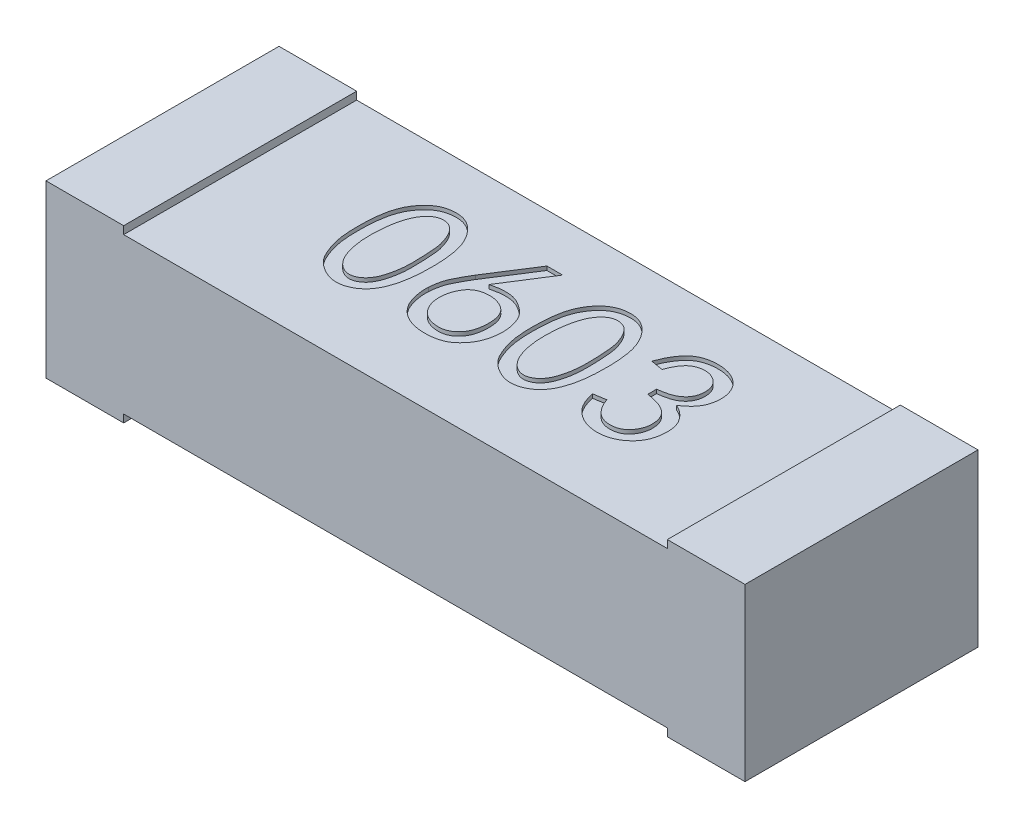
from build123d import *

# Parameters (mm, degrees)
SKETCH_1_W           = 1.4
SKETCH_1_H           = 0.6
EXTRUDE_1_DEPTH      = 0.4
EXTRUDE_2_DEPTH      = 0.42
EXTRUDE_2_DEPTH_BACK = 0.02
SKETCH_3_W           = 0.2
SKETCH_3_H           = 0.6
CUT_EXTRUDE_1_DEPTH  = 0.01


with BuildPart() as part:
    # 草图1 → 凸台-拉伸1 (new body)
    with BuildSketch(Plane(origin=(0, 0, 0), x_dir=(1, 0, 0), z_dir=(0, 1, 0))):
        with Locations((0.9, 0.3)):
            Rectangle(SKETCH_1_W, SKETCH_1_H)
    extrude(amount=EXTRUDE_1_DEPTH)

    # 草图3 → 凸台-拉伸2 (add, two sides: drawn at the far end of the back side and taken through both)
    with BuildSketch(Plane(origin=(0, 0, 0), x_dir=(1, 0, 0), z_dir=(0, 1, 0)).offset(-EXTRUDE_2_DEPTH_BACK)):
        with Locations((0.1, 0.3)):
            Rectangle(SKETCH_3_W, SKETCH_3_H)
        with Locations((1.7, 0.3)):
            Rectangle(SKETCH_3_W, SKETCH_3_H)
    extrude(amount=EXTRUDE_2_DEPTH + EXTRUDE_2_DEPTH_BACK)

    # 草图4 → 切除-拉伸1 (cut)
    # profile 1 of 4: a face of its own
    with BuildSketch(Plane(origin=(0, 0.4, 0), x_dir=(1, 0, 0), z_dir=(0, 1, 0))):
        with BuildLine():
            add(Edge.make_bspline(
                [(0.483421092, 0.340757497), (0.483588156, 0.344527937), (0.483913999, 0.351881852), (0.484855426, 0.362604689), (0.485992295, 0.372752951), (0.487470375, 0.382295602), (0.489297207, 0.39120088), (0.491364957, 0.399515455), (0.493754568, 0.407216063), (0.497273219, 0.416620761), (0.502549605, 0.427445454), (0.510096898, 0.439342567), (0.518867102, 0.450037235), (0.527163995, 0.457873569), (0.534357962, 0.463388817), (0.540105805, 0.466969689), (0.546144457, 0.470029274), (0.552493722, 0.47252443), (0.559141923, 0.474383081), (0.566071449, 0.475755304), (0.573305168, 0.476604181), (0.58075916, 0.476856733), (0.588269318, 0.476503115), (0.595646974, 0.475351126), (0.602766282, 0.473306052), (0.609632105, 0.470498488), (0.616225758, 0.466891117), (0.62258043, 0.462512914), (0.628620786, 0.457250654), (0.634422109, 0.45131801), (0.639840715, 0.444788663), (0.644804146, 0.437788625), (0.649291783, 0.4303901), (0.653243811, 0.422552499), (0.656786335, 0.414344934), (0.659758198, 0.405694297), (0.662216902, 0.396635733), (0.664924319, 0.383838922), (0.66730626, 0.366864283), (0.668984368, 0.345380882), (0.669367286, 0.322473558), (0.668797114, 0.302663413), (0.667722326, 0.286612625), (0.666500411, 0.274970789), (0.664859168, 0.263922228), (0.662948566, 0.253413162), (0.660558286, 0.243499479), (0.65772578, 0.234170558), (0.654665383, 0.225365453), (0.651063131, 0.217176722), (0.647139714, 0.209534821), (0.642666682, 0.202537638), (0.637820777, 0.196090663), (0.632473539, 0.190244983), (0.626555302, 0.185118355), (0.620271971, 0.1804634), (0.6134548, 0.176501509), (0.60628545, 0.173139459), (0.598901559, 0.170463695), (0.591395312, 0.168719712), (0.583908309, 0.167683158), (0.576387791, 0.167679366), (0.568878315, 0.168333241), (0.561410721, 0.170053295), (0.553892899, 0.172418183), (0.546526215, 0.175762583), (0.539435956, 0.179613492), (0.532762132, 0.183758227), (0.52668713, 0.188268292), (0.521162409, 0.193084671), (0.516119051, 0.198166924), (0.511616575, 0.203563298), (0.507701714, 0.209288735), (0.503326928, 0.217346527), (0.498640135, 0.227740102), (0.49378933, 0.240542491), (0.489824751, 0.253652824), (0.487275446, 0.264919213), (0.485594692, 0.274344409), (0.484669939, 0.282070723), (0.483866651, 0.290387797), (0.483381167, 0.299297568), (0.483058239, 0.30880776), (0.482917695, 0.318925149), (0.483068122, 0.329648558), (0.483301359, 0.336989142), (0.483421092, 0.340757497)],
                knots=[0, 0, 0, 0, 1.18043416, 2.302333746, 3.366253517, 4.374302266, 5.321670991, 6.208995316, 7.053297808, 7.84229274, 9.348259463, 10.810477328, 12.240076564, 13.663562249, 14.3695339, 15.072606272, 15.778577923, 16.484387009, 17.202829605, 17.934942377, 18.692112664, 19.478485278, 20.265441384, 21.040673806, 21.808439453, 22.577161074, 23.356320991, 24.155029842, 24.986154494, 25.858111265, 26.748121484, 27.637306138, 28.540117759, 29.452135788, 30.380885827, 31.334339875, 32.310628684, 33.31521083, 35.42407972, 37.666773946, 40.052062172, 42.587025658, 43.863776122, 45.083322308, 46.247467896, 47.357025429, 48.423487632, 49.435172604, 50.405897663, 51.337337341, 52.231284254, 53.090220275, 53.931690991, 54.751583713, 55.562922169, 56.377338113, 57.194202079, 58.024663732, 58.851830165, 59.645552351, 60.431282623, 61.21044254, 61.99312915, 62.783838437, 63.60230231, 64.454612977, 65.309477934, 66.125301685, 66.909862715, 67.67340185, 68.415973016, 69.147238889, 69.868837108, 70.581506411, 72.0124375, 73.431838244, 74.861437481, 76.292961888, 77.042577341, 77.855187732, 78.726196438, 79.655959089, 80.645695907, 81.702690171, 82.820655125, 84, 84, 84, 84], degree=3))
        make_face()
        with BuildLine():
            add(Edge.make_bspline(
                [(0.520263198, 0.351283812), (0.519864896, 0.347322739), (0.519080229, 0.339519286), (0.518438465, 0.327943015), (0.51825558, 0.316694444), (0.518423053, 0.305769024), (0.519068909, 0.295188132), (0.520170848, 0.28493129), (0.521740527, 0.275005699), (0.523661676, 0.26543768), (0.525963476, 0.256380159), (0.528693228, 0.247956197), (0.531800341, 0.240227159), (0.535237539, 0.233181404), (0.539010532, 0.22681052), (0.543189577, 0.221150685), (0.547657427, 0.216081494), (0.552547605, 0.211821439), (0.557563193, 0.208243912), (0.562691074, 0.205464208), (0.567847614, 0.203494508), (0.573052495, 0.202290148), (0.578286957, 0.201905603), (0.583553085, 0.20227809), (0.588811928, 0.203578168), (0.594037363, 0.20557072), (0.59907947, 0.208315091), (0.60384948, 0.211628932), (0.608247937, 0.215586369), (0.612277165, 0.220144921), (0.615914125, 0.225332787), (0.619241879, 0.231061275), (0.622163899, 0.237425401), (0.625599944, 0.246743615), (0.629060369, 0.259152981), (0.632139015, 0.274659542), (0.633954876, 0.290830865), (0.634430976, 0.307422637), (0.634121416, 0.323908613), (0.633750138, 0.339878961), (0.632857387, 0.355063835), (0.631788941, 0.369540555), (0.629975689, 0.383373758), (0.626634107, 0.396490988), (0.62195353, 0.408927814), (0.617149426, 0.418745421), (0.612545308, 0.425871899), (0.608915773, 0.43065356), (0.604880657, 0.434649212), (0.600625861, 0.438055528), (0.596052409, 0.440648828), (0.59120166, 0.442588677), (0.586075734, 0.443790817), (0.580752311, 0.44438357), (0.575389145, 0.444279948), (0.570121221, 0.443338612), (0.565011869, 0.441692346), (0.560028939, 0.439348685), (0.555276977, 0.436176606), (0.550680027, 0.432294276), (0.546289876, 0.427636321), (0.541965295, 0.422329158), (0.538020525, 0.416166508), (0.534372309, 0.409263181), (0.53113702, 0.40153048), (0.528239485, 0.393013161), (0.525637219, 0.383711685), (0.523449237, 0.373620457), (0.521633598, 0.362731434), (0.52073041, 0.355186667), (0.520263198, 0.351283812)],
                knots=[0, 0, 0, 0, 1.378198314, 2.715098627, 4.012594964, 5.272602849, 6.497213731, 7.681415101, 8.842769074, 9.975170128, 11.059162755, 12.076494648, 13.038717388, 13.940857576, 14.788360499, 15.598271168, 16.373595835, 17.122768248, 17.838466736, 18.502782022, 19.136468245, 19.744060339, 20.345653328, 20.947246317, 21.563841626, 22.214212994, 22.87852828, 23.546305104, 24.220743313, 24.921956094, 25.648106704, 26.41081768, 27.212668989, 28.069279432, 29.84713992, 31.666334073, 33.537864714, 35.473745168, 37.408579624, 39.246547954, 41.003985019, 42.674193204, 44.272363647, 45.827394737, 47.348405091, 48.867584295, 49.599750274, 50.283750763, 50.94125936, 51.560811542, 52.165388272, 52.754418158, 53.363720025, 53.982318455, 54.604903792, 55.213928724, 55.828148287, 56.458765578, 57.113918044, 57.800421407, 58.537638978, 59.326979919, 60.167286366, 61.066273245, 62.027297208, 63.065989643, 64.179487018, 65.369443928, 66.639232213, 68, 68, 68, 68], degree=3))
        make_face(mode=Mode.SUBTRACT)
    # profile 2 of 4: a face of its own
    with BuildSketch(Plane(origin=(0, 0.4, 0), x_dir=(1, 0, 0), z_dir=(0, 1, 0))):
        with BuildLine():
            add(Edge.make_bspline(
                [(0.9325439, 0.340757497), (0.932710963, 0.344527937), (0.933036806, 0.351881852), (0.933978233, 0.362604689), (0.935115102, 0.372752951), (0.936593182, 0.382295602), (0.938420014, 0.39120088), (0.940487764, 0.399515455), (0.942877375, 0.407216063), (0.946396026, 0.416620761), (0.951672412, 0.427445454), (0.959219705, 0.439342567), (0.967989909, 0.450037235), (0.976286802, 0.457873569), (0.983480769, 0.463388817), (0.989228612, 0.466969689), (0.995267264, 0.470029274), (1.001616529, 0.47252443), (1.00826473, 0.474383081), (1.015194256, 0.475755304), (1.022427975, 0.476604181), (1.029881967, 0.476856733), (1.037392125, 0.476503115), (1.044769781, 0.475351126), (1.051889089, 0.473306052), (1.058754912, 0.470498488), (1.065348565, 0.466891117), (1.071703237, 0.462512914), (1.077743593, 0.457250654), (1.083544916, 0.45131801), (1.088963522, 0.444788663), (1.093926953, 0.437788625), (1.09841459, 0.4303901), (1.102366618, 0.422552499), (1.105909142, 0.414344934), (1.108881005, 0.405694297), (1.111339709, 0.396635733), (1.114047126, 0.383838922), (1.116429067, 0.366864283), (1.118107175, 0.345380882), (1.118490093, 0.322473558), (1.117919921, 0.302663413), (1.116845133, 0.286612625), (1.115623219, 0.274970789), (1.113981975, 0.263922228), (1.112071373, 0.253413162), (1.109681093, 0.243499479), (1.106848587, 0.234170558), (1.10378819, 0.225365453), (1.100185938, 0.217176722), (1.096262521, 0.209534821), (1.091789489, 0.202537638), (1.086943584, 0.196090663), (1.081596346, 0.190244983), (1.075678109, 0.185118355), (1.069394778, 0.1804634), (1.062577607, 0.176501509), (1.055408257, 0.173139459), (1.048024366, 0.170463695), (1.040518119, 0.168719712), (1.033031116, 0.167683158), (1.025510598, 0.167679366), (1.018001122, 0.168333241), (1.010533528, 0.170053295), (1.003015706, 0.172418183), (0.995649022, 0.175762583), (0.988558763, 0.179613492), (0.981884939, 0.183758227), (0.975809937, 0.188268292), (0.970285216, 0.193084671), (0.965241858, 0.198166924), (0.960739382, 0.203563298), (0.956824521, 0.209288735), (0.952449735, 0.217346527), (0.947762942, 0.227740102), (0.942912137, 0.240542491), (0.938947558, 0.253652824), (0.936398253, 0.264919213), (0.934717499, 0.274344409), (0.933792746, 0.282070723), (0.932989458, 0.290387797), (0.932503974, 0.299297568), (0.932181046, 0.30880776), (0.932040502, 0.318925149), (0.932190929, 0.329648558), (0.932424166, 0.336989142), (0.9325439, 0.340757497)],
                knots=[0, 0, 0, 0, 1.18043416, 2.302333746, 3.366253517, 4.374302266, 5.321670991, 6.208995316, 7.053297808, 7.84229274, 9.348259463, 10.810477328, 12.240076564, 13.663562249, 14.3695339, 15.072606272, 15.778577923, 16.484387009, 17.202829605, 17.934942377, 18.692112664, 19.478485278, 20.265441384, 21.040673806, 21.808439453, 22.577161074, 23.356320991, 24.155029842, 24.986154494, 25.858111265, 26.748121484, 27.637306138, 28.540117759, 29.452135788, 30.380885827, 31.334339875, 32.310628684, 33.31521083, 35.42407972, 37.666773946, 40.052062172, 42.587025658, 43.863776122, 45.083322308, 46.247467896, 47.357025429, 48.423487632, 49.435172604, 50.405897663, 51.337337341, 52.231284254, 53.090220275, 53.931690991, 54.751583713, 55.562922169, 56.377338113, 57.194202079, 58.024663732, 58.851830165, 59.645552351, 60.431282623, 61.21044254, 61.99312915, 62.783838437, 63.60230231, 64.454612977, 65.309477934, 66.125301685, 66.909862715, 67.67340185, 68.415973016, 69.147238889, 69.868837108, 70.581506411, 72.0124375, 73.431838244, 74.861437481, 76.292961888, 77.042577341, 77.855187732, 78.726196438, 79.655959089, 80.645695907, 81.702690171, 82.820655125, 84, 84, 84, 84], degree=3))
        make_face()
        with BuildLine():
            add(Edge.make_bspline(
                [(0.969386005, 0.351283812), (0.968987703, 0.347322739), (0.968203036, 0.339519286), (0.967561272, 0.327943015), (0.967378387, 0.316694444), (0.96754586, 0.305769024), (0.968191716, 0.295188132), (0.969293655, 0.28493129), (0.970863334, 0.275005699), (0.972784483, 0.26543768), (0.975086284, 0.256380159), (0.977816035, 0.247956197), (0.980923148, 0.240227159), (0.984360346, 0.233181404), (0.988133339, 0.22681052), (0.992312384, 0.221150685), (0.996780234, 0.216081494), (1.001670412, 0.211821439), (1.006686, 0.208243912), (1.011813881, 0.205464208), (1.016970421, 0.203494508), (1.022175302, 0.202290148), (1.027409764, 0.201905603), (1.032675893, 0.20227809), (1.037934735, 0.203578168), (1.04316017, 0.20557072), (1.048202277, 0.208315091), (1.052972287, 0.211628932), (1.057370744, 0.215586369), (1.061399972, 0.220144921), (1.065036932, 0.225332787), (1.068364686, 0.231061275), (1.071286707, 0.237425401), (1.074722751, 0.246743615), (1.078183176, 0.259152981), (1.081261822, 0.274659542), (1.083077683, 0.290830865), (1.083553783, 0.307422637), (1.083244223, 0.323908613), (1.082872945, 0.339878961), (1.081980194, 0.355063835), (1.080911748, 0.369540555), (1.079098496, 0.383373758), (1.075756914, 0.396490988), (1.071076337, 0.408927814), (1.066272233, 0.418745421), (1.061668115, 0.425871899), (1.05803858, 0.43065356), (1.054003464, 0.434649212), (1.049748668, 0.438055528), (1.045175216, 0.440648828), (1.040324467, 0.442588677), (1.035198541, 0.443790817), (1.029875118, 0.44438357), (1.024511952, 0.444279948), (1.019244028, 0.443338612), (1.014134676, 0.441692346), (1.009151746, 0.439348685), (1.004399784, 0.436176606), (0.999802834, 0.432294276), (0.995412683, 0.427636321), (0.991088102, 0.422329158), (0.987143332, 0.416166508), (0.983495116, 0.409263181), (0.980259828, 0.40153048), (0.977362292, 0.393013161), (0.974760026, 0.383711685), (0.972572044, 0.373620457), (0.970756405, 0.362731434), (0.969853217, 0.355186667), (0.969386005, 0.351283812)],
                knots=[0, 0, 0, 0, 1.378198314, 2.715098627, 4.012594964, 5.272602849, 6.497213731, 7.681415101, 8.842769074, 9.975170128, 11.059162755, 12.076494648, 13.038717388, 13.940857576, 14.788360499, 15.598271168, 16.373595835, 17.122768248, 17.838466736, 18.502782022, 19.136468245, 19.744060339, 20.345653328, 20.947246317, 21.563841626, 22.214212994, 22.87852828, 23.546305104, 24.220743313, 24.921956094, 25.648106704, 26.41081768, 27.212668989, 28.069279432, 29.84713992, 31.666334073, 33.537864714, 35.473745168, 37.408579624, 39.246547954, 41.003985019, 42.674193204, 44.272363647, 45.827394737, 47.348405091, 48.867584295, 49.599750274, 50.283750763, 50.94125936, 51.560811542, 52.165388272, 52.754418158, 53.363720025, 53.982318455, 54.604903792, 55.213928724, 55.828148287, 56.458765578, 57.113918044, 57.800421407, 58.537638978, 59.326979919, 60.167286366, 61.066273245, 62.027297208, 63.065989643, 64.179487018, 65.369443928, 66.639232213, 68, 68, 68, 68], degree=3))
        make_face(mode=Mode.SUBTRACT)
    # profile 3 of 4: a face of its own
    with BuildSketch(Plane(origin=(0, 0.4, 0), x_dir=(1, 0, 0), z_dir=(0, 1, 0))):
        with BuildLine():
            add(Edge.make_bspline(
                [(0.709736882, 0.275845216), (0.710074782, 0.27992669), (0.710729053, 0.287829584), (0.712869853, 0.299087527), (0.715520512, 0.309438082), (0.719260015, 0.319037437), (0.724046426, 0.328589253), (0.72936939, 0.339070546), (0.735863708, 0.350554644), (0.740586322, 0.358526797), (0.743070215, 0.36271981)],
                knots=[0, 0, 0, 0, 1.042998706, 2.019541814, 2.916615498, 3.762308625, 4.638715294, 5.638536551, 6.75797084, 8, 8, 8, 8], degree=3))
            Line((0.743070215, 0.36271981), (0.81500004, 0.475000512))
            Line((0.81500004, 0.475000512), (0.855350917, 0.475000512))
            Line((0.855350917, 0.475000512), (0.781666707, 0.359211038))
            add(Edge.make_bspline(
                [(0.781666707, 0.359211038), (0.78551045, 0.360153045), (0.792934792, 0.361972568), (0.803904257, 0.363737386), (0.814267802, 0.364600453), (0.824028506, 0.364625256), (0.833200245, 0.363817866), (0.841773884, 0.36207017), (0.849761248, 0.359404106), (0.857086374, 0.35585222), (0.863766248, 0.351817257), (0.869914743, 0.347635075), (0.875516244, 0.34336845), (0.880532811, 0.338940749), (0.88501044, 0.334392749), (0.888802332, 0.329617531), (0.892217863, 0.324829443), (0.895668712, 0.318103376), (0.899291796, 0.309471899), (0.902458255, 0.298656435), (0.904558063, 0.287401495), (0.905475272, 0.275821923), (0.905467617, 0.264072569), (0.904173998, 0.252355569), (0.901930574, 0.240723429), (0.898472078, 0.229287778), (0.893853127, 0.218073941), (0.887514093, 0.207413437), (0.879652455, 0.19729434), (0.871930313, 0.189478655), (0.865040641, 0.183634189), (0.859169039, 0.179882611), (0.852873314, 0.176558496), (0.846062753, 0.173759643), (0.838783953, 0.171477083), (0.830987074, 0.169829656), (0.822722825, 0.16857601), (0.81408166, 0.167908596), (0.805379701, 0.16767449), (0.796876264, 0.168106509), (0.788689272, 0.168912965), (0.780826944, 0.170275452), (0.77327894, 0.172155134), (0.766102439, 0.174633877), (0.759210878, 0.177573932), (0.752685798, 0.180994601), (0.746550485, 0.184874192), (0.740978213, 0.189273586), (0.735794773, 0.193932014), (0.731173223, 0.199051329), (0.726981318, 0.204504105), (0.723370432, 0.210391505), (0.72011743, 0.216592024), (0.71669119, 0.225361859), (0.713341609, 0.236483345), (0.710669611, 0.249818825), (0.709221469, 0.26293003), (0.70956651, 0.271576049), (0.709736882, 0.275845216)],
                knots=[0, 0, 0, 0, 1.30987361, 2.530072464, 3.674076933, 4.749737101, 5.758005553, 6.717161001, 7.640113921, 8.538216801, 9.406478839, 10.221965151, 10.999356528, 11.736024514, 12.43585607, 13.108943968, 13.753423114, 14.378993464, 15.606901413, 16.848076322, 18.102664827, 19.390785032, 20.688768111, 21.98673138, 23.287623163, 24.605715361, 25.936233508, 27.292778926, 28.698472844, 30.169013905, 30.922829238, 31.684618084, 32.470496446, 33.277520399, 34.118983406, 34.992471271, 35.913332431, 36.884634966, 37.860137434, 38.793368636, 39.701719614, 40.582389804, 41.432879653, 42.274220425, 43.093418803, 43.911360741, 44.711055379, 45.492833336, 46.259332936, 47.015702139, 47.772988627, 48.533121813, 49.299654956, 50.087983324, 51.646482558, 53.138633408, 54.587135849, 56, 56, 56, 56], degree=3))
        make_face()
        with BuildLine():
            add(Edge.make_bspline(
                [(0.764122847, 0.217950479), (0.765461864, 0.216622621), (0.768149418, 0.213957464), (0.772625526, 0.210486629), (0.77742579, 0.207441453), (0.782563269, 0.204945376), (0.787998498, 0.202802114), (0.793795336, 0.201319379), (0.799880981, 0.200083672), (0.806212919, 0.199500201), (0.812587955, 0.199284748), (0.818787986, 0.199927724), (0.824741875, 0.201031099), (0.830393052, 0.202984483), (0.835794225, 0.205498514), (0.840901912, 0.208708726), (0.845671164, 0.212619131), (0.850210379, 0.217050705), (0.854320442, 0.222146276), (0.857903316, 0.227842957), (0.8609565, 0.234092578), (0.863426952, 0.240889954), (0.865287912, 0.248209628), (0.866646234, 0.256051905), (0.867491505, 0.264454531), (0.867714636, 0.273203697), (0.867451022, 0.281894646), (0.866453952, 0.290087731), (0.864666729, 0.297539228), (0.862374367, 0.304348354), (0.859246871, 0.310404242), (0.855416825, 0.315765012), (0.850931214, 0.320425775), (0.845713563, 0.324231027), (0.840170749, 0.327431592), (0.834421001, 0.330106449), (0.828534253, 0.332270327), (0.822473407, 0.333912249), (0.816204707, 0.334952629), (0.809765805, 0.335384554), (0.803183374, 0.335315413), (0.796553205, 0.334744075), (0.790048242, 0.333633585), (0.783940175, 0.331792108), (0.778252601, 0.329445403), (0.773023554, 0.326470094), (0.76834358, 0.322770191), (0.764044199, 0.31858346), (0.760277936, 0.313732594), (0.75592562, 0.306555427), (0.751618502, 0.296959561), (0.748030468, 0.284942166), (0.746279303, 0.272570974), (0.746299828, 0.262130981), (0.747132968, 0.25389128), (0.748236432, 0.247933805), (0.749814752, 0.242272668), (0.751749065, 0.236845066), (0.754165874, 0.231689531), (0.757041086, 0.226799855), (0.760334177, 0.222175099), (0.762860979, 0.219357546), (0.764122847, 0.217950479)],
                knots=[0, 0, 0, 0, 0.824379014, 1.654618615, 2.472217002, 3.307040171, 4.149944448, 5.023399345, 5.920986251, 6.863846236, 7.802124107, 8.706338671, 9.585327007, 10.445314643, 11.314286422, 12.187124327, 13.076521263, 14.007883694, 14.9579535, 15.93325223, 16.946080417, 17.995267438, 19.091535754, 20.245890406, 21.474436714, 22.782621587, 24.072176649, 25.275692408, 26.385796877, 27.419682211, 28.411368294, 29.355370333, 30.293504652, 31.227802789, 32.170424673, 33.090341057, 33.998667172, 34.911184711, 35.833391934, 36.773820451, 37.730905064, 38.710612777, 39.6827302, 40.612114241, 41.495534864, 42.369965774, 43.234275376, 44.098636918, 44.989546864, 45.912629924, 47.765713501, 49.573670898, 51.382745352, 53.211540175, 54.12612168, 55.003320594, 55.858492095, 56.694765964, 57.521374723, 58.34531796, 59.173662839, 60, 60, 60, 60], degree=3))
        make_face(mode=Mode.SUBTRACT)
    # profile 4 of 4: a face of its own
    with BuildSketch(Plane(origin=(0, 0.4, 0), x_dir=(1, 0, 0), z_dir=(0, 1, 0))):
        with BuildLine():
            Line((1.158859689, 0.248684722), (1.190438636, 0.25394788))
            add(Edge.make_bspline(
                [(1.190438636, 0.25394788), (1.191683415, 0.250269146), (1.194128328, 0.243043618), (1.199411169, 0.233064761), (1.205725479, 0.224060941), (1.21178335, 0.21731818), (1.217259013, 0.212713703), (1.221577796, 0.209700655), (1.226116642, 0.207115825), (1.231003489, 0.20521935), (1.236058179, 0.203587389), (1.241417095, 0.202671362), (1.246977183, 0.202148003), (1.252698196, 0.202057985), (1.258400235, 0.202579265), (1.26390698, 0.203621377), (1.269131277, 0.205161903), (1.274051324, 0.207313301), (1.278597646, 0.210101072), (1.28294537, 0.213271322), (1.286927366, 0.217082547), (1.290505539, 0.221418191), (1.293741747, 0.226072156), (1.296538538, 0.230935179), (1.298848888, 0.235974676), (1.300574934, 0.241192665), (1.301917369, 0.246551607), (1.302658206, 0.252085346), (1.303013449, 0.257778496), (1.302780829, 0.263558146), (1.302192342, 0.269264933), (1.300990162, 0.274719576), (1.299372993, 0.27982586), (1.297365668, 0.284679799), (1.294750404, 0.289114402), (1.291739195, 0.293262295), (1.28826775, 0.297072635), (1.284251563, 0.300523995), (1.279731535, 0.303727768), (1.27460772, 0.306686262), (1.268808229, 0.30928486), (1.262455623, 0.3117899), (1.255420018, 0.313900365), (1.247792024, 0.315841761), (1.239509549, 0.317539833), (1.233761309, 0.318410192), (1.230789514, 0.318860161)],
                knots=[0, 0, 0, 0, 1.854799748, 3.643076762, 5.375778243, 7.105784308, 7.958514958, 8.791774595, 9.621744654, 10.44880128, 11.294076632, 12.157496915, 13.041787632, 13.96367637, 14.889223527, 15.774908308, 16.640004354, 17.48869958, 18.334228731, 19.185637365, 20.057465777, 20.961908388, 21.86984341, 22.765285775, 23.641349219, 24.5158806, 25.390105247, 26.279235462, 27.181837661, 28.114543598, 29.042174801, 29.921843334, 30.780091711, 31.601551697, 32.427634894, 33.235597725, 34.049381879, 34.886366892, 35.762920031, 36.695625967, 37.710569643, 38.799256358, 39.959035312, 41.220118669, 42.562822875, 44, 44, 44, 44], degree=3))
            Line((1.230789514, 0.318860161), (1.230789514, 0.341667178))
            add(Edge.make_bspline(
                [(1.230789514, 0.341667178), (1.23376286, 0.341970777), (1.239518447, 0.342558463), (1.24778943, 0.344115133), (1.255449255, 0.345868265), (1.262464299, 0.348095802), (1.268857968, 0.350691231), (1.274655793, 0.35364031), (1.279786351, 0.35706195), (1.284287087, 0.36084263), (1.288222813, 0.364952678), (1.291543672, 0.369391304), (1.294312638, 0.374111902), (1.296474526, 0.379155118), (1.297998965, 0.384510948), (1.299092942, 0.39013878), (1.29941582, 0.396071502), (1.299301593, 0.402178198), (1.298648095, 0.408225032), (1.297256514, 0.413955432), (1.295297321, 0.419254578), (1.292796722, 0.424176967), (1.289528153, 0.428565204), (1.285752485, 0.432561637), (1.281350617, 0.436087277), (1.276427273, 0.4391153), (1.271157873, 0.441588362), (1.265765055, 0.443601975), (1.260249176, 0.444809886), (1.254678376, 0.445465363), (1.249006959, 0.44556778), (1.243262823, 0.444860468), (1.237428305, 0.44362143), (1.231543327, 0.441762037), (1.225688671, 0.439138896), (1.220197948, 0.435350719), (1.215063363, 0.430595191), (1.21010772, 0.424961262), (1.205643102, 0.418208236), (1.20132929, 0.410582969), (1.197349853, 0.401955469), (1.195113053, 0.395768521), (1.193947408, 0.392544371)],
                knots=[0, 0, 0, 0, 1.385117707, 2.68120955, 3.899080185, 5.026526245, 6.089471502, 7.095537128, 8.036926677, 8.942108935, 9.815771246, 10.669349366, 11.506404864, 12.347666396, 13.205663414, 14.084102859, 14.999917747, 15.954128211, 16.914501223, 17.813254747, 18.680661639, 19.529560311, 20.363114732, 21.208382436, 22.07252795, 22.96987783, 23.881720011, 24.767988279, 25.632833695, 26.492298631, 27.366018653, 28.255410494, 29.169296362, 30.128408489, 31.112431375, 32.1318401, 33.205217515, 34.351116983, 35.601710711, 36.950682265, 38.410935554, 40, 40, 40, 40], degree=3))
            Line((1.193947408, 0.392544371), (1.162368461, 0.397807529))
            add(Edge.make_bspline(
                [(1.162368461, 0.397807529), (1.164209288, 0.402888879), (1.167796306, 0.412790346), (1.174499276, 0.426713394), (1.182278519, 0.439261067), (1.189571156, 0.448731214), (1.195976532, 0.455532409), (1.201288299, 0.459916575), (1.206919048, 0.46390124), (1.213016004, 0.467235057), (1.219506856, 0.470078419), (1.226423662, 0.472253587), (1.233722926, 0.473945993), (1.241328859, 0.475094358), (1.248992839, 0.475702847), (1.256523423, 0.475950198), (1.263810751, 0.475571061), (1.270878088, 0.474926138), (1.277667982, 0.473652726), (1.284220545, 0.47198565), (1.290494694, 0.469742249), (1.296563009, 0.467181245), (1.302233114, 0.4641183), (1.307573806, 0.460763942), (1.312353242, 0.456869504), (1.316850377, 0.452752719), (1.320711174, 0.448070105), (1.32427628, 0.443104082), (1.327384853, 0.437736751), (1.329961346, 0.431993425), (1.332113409, 0.426045884), (1.333723819, 0.419886258), (1.334925313, 0.413617547), (1.335489029, 0.407176558), (1.335555003, 0.400637327), (1.33508743, 0.393947157), (1.334099405, 0.387131032), (1.332636643, 0.380206302), (1.330531556, 0.373285798), (1.327500415, 0.366555156), (1.323647812, 0.360052472), (1.318980925, 0.353768196), (1.313507122, 0.347708428), (1.307144878, 0.341949274), (1.300047967, 0.336310293), (1.294863921, 0.332898612), (1.292193022, 0.331140862)],
                knots=[0, 0, 0, 0, 2.088435488, 4.069504719, 5.960900737, 7.786563479, 8.680771598, 9.566313178, 10.444341104, 11.343825986, 12.247587673, 13.179685867, 14.142420713, 15.141886465, 16.150152099, 17.113396579, 18.05212794, 18.969441419, 19.854666253, 20.719823891, 21.58047219, 22.428151748, 23.263500765, 24.069461113, 24.861911808, 25.643808195, 26.422154676, 27.202794716, 28.005617324, 28.815006474, 29.633397489, 30.44783822, 31.273903418, 32.097929155, 32.94366283, 33.799737089, 34.68784804, 35.604243899, 36.533818883, 37.478357806, 38.450549751, 39.450331118, 40.49965591, 41.60193164, 42.764479089, 44, 44, 44, 44], degree=3))
            add(Edge.make_bspline(
                [(1.292193022, 0.331140862), (1.296112971, 0.329285624), (1.303787133, 0.325653588), (1.314049251, 0.318305637), (1.322858793, 0.309641876), (1.328955754, 0.301349396), (1.33307586, 0.294117575), (1.335528534, 0.288173488), (1.337403573, 0.281830069), (1.338758479, 0.275110732), (1.339618436, 0.267984879), (1.339833803, 0.260445086), (1.339582245, 0.252477794), (1.338734801, 0.244251147), (1.33738005, 0.235992785), (1.335206077, 0.228041255), (1.332426055, 0.220483989), (1.328949045, 0.213307056), (1.324746563, 0.206573146), (1.319783326, 0.200295983), (1.314280624, 0.194336769), (1.308037965, 0.188949441), (1.301423974, 0.184041368), (1.294482805, 0.179789358), (1.287339438, 0.176202373), (1.279965931, 0.173325913), (1.27236762, 0.171176455), (1.264561739, 0.169691799), (1.256520889, 0.168822615), (1.248347649, 0.168730013), (1.240195591, 0.169215969), (1.232259418, 0.170434748), (1.224562735, 0.172060084), (1.217174643, 0.174466745), (1.210010691, 0.177342482), (1.203198113, 0.180959588), (1.196623855, 0.185087338), (1.190353982, 0.189789056), (1.184483089, 0.195125009), (1.179145256, 0.201077224), (1.174290932, 0.207564806), (1.170184888, 0.214734844), (1.166399967, 0.22235362), (1.163355821, 0.230632092), (1.16068941, 0.239427733), (1.159478698, 0.24555301), (1.158859689, 0.248684722)],
                knots=[0, 0, 0, 0, 1.556863988, 3.047903747, 4.51274202, 5.983117829, 6.732724558, 7.500714565, 8.289161914, 9.10779992, 9.96267821, 10.866591561, 11.817204889, 12.826910154, 13.838355827, 14.822602624, 15.786048742, 16.729939345, 17.685039949, 18.633769323, 19.603521256, 20.596937443, 21.593797024, 22.562140776, 23.519904659, 24.464277043, 25.403497682, 26.355035653, 27.318261422, 28.307425488, 29.290655039, 30.251043242, 31.192037974, 32.115630974, 33.041191859, 33.964292232, 34.884727864, 35.830159304, 36.778345149, 37.732302073, 38.701115445, 39.685485474, 40.699027657, 41.756353326, 42.852875359, 44, 44, 44, 44], degree=3))
        make_face()
    extrude(amount=-CUT_EXTRUDE_1_DEPTH, mode=Mode.SUBTRACT)


solid = part.part
